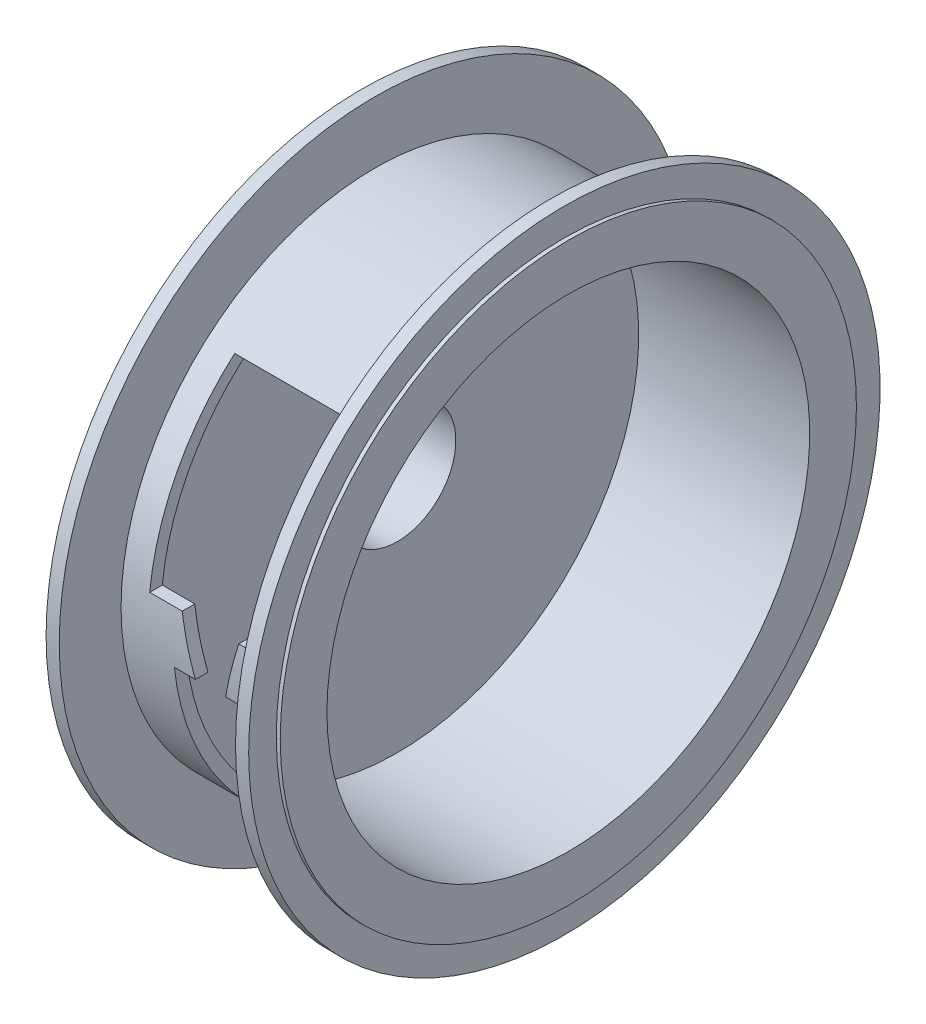
from build123d import *

# Parameters (mm, degrees)
KES_EKSTR_ZYON1_DEPTH = 38.65222437


with BuildPart() as part:
    # Çizim1 → Döndür1 (revolve)
    with BuildSketch(Plane.XY, mode=Mode.PRIVATE) as d_nd_r1_sk:
        Polygon((0.3, 18.5), (0.3, 21.9), (0.6, 21.9), (0.6, 24), (1.6, 24), (1.6, 19.3), (15, 19.3), (15, 24), (16, 24), (16, 21.9), (16.3, 21.9), (16.3, 18.35), (3.3, 18.35), (3.3, 4.45), (0, 4.45), (0, 6.1), (2, 6.1), (2, 18.5), align=None)
    revolve(d_nd_r1_sk.sketch.rotate(Axis((-5.366453406, 0, 0), (1, 0, 0)), 90), axis=Axis((-5.366453406, 0, 0), (1, 0, 0)))

    # Çizim2 → Kes-Ekstrüzyon1 (cut, through all)
    with BuildSketch(Plane.XY):
        Polygon((12.925, 14.5), (3.675, 14.5), (3.675, 2), (6.15, 2), (7.15, -2), (5.55, -2), (5.55, -14.5), (11.05, -14.5), (11.05, -2), (9.45, -2), (10.45, 2), (12.925, 2), align=None)
    extrude(amount=KES_EKSTR_ZYON1_DEPTH, mode=Mode.SUBTRACT)


solid = part.part
